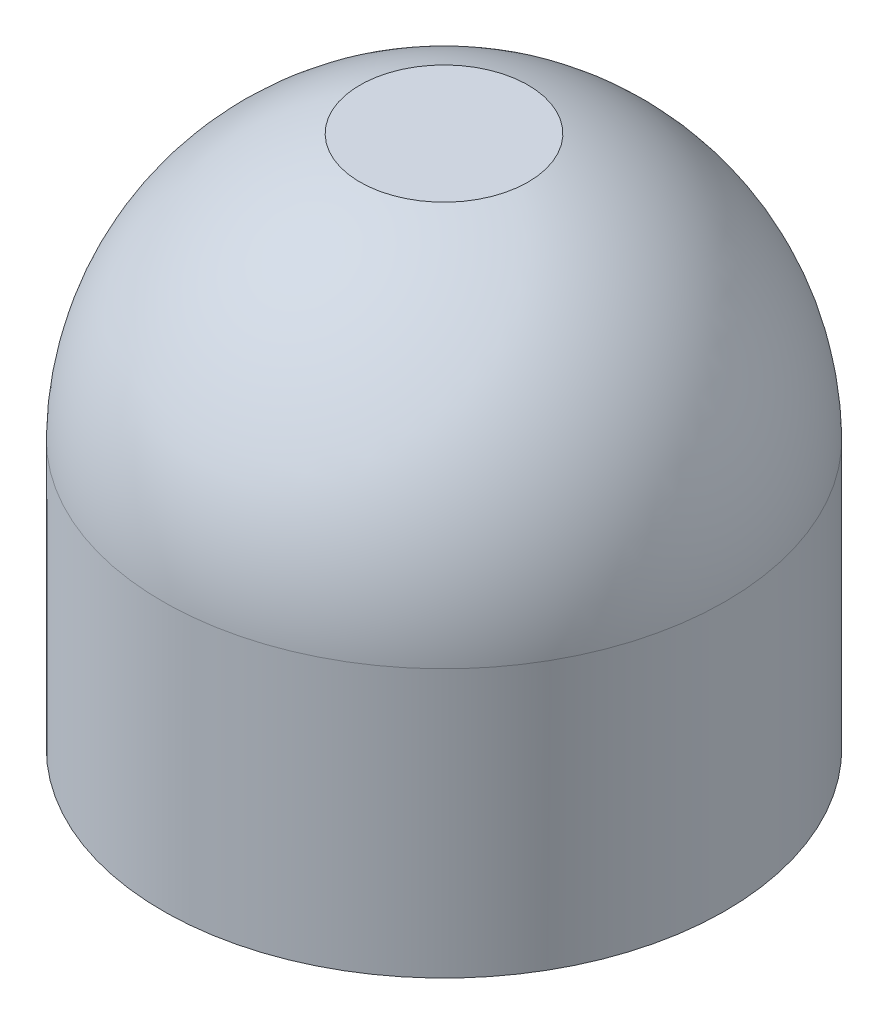
from build123d import *

# Parameters (mm, degrees)
SKETCH1_R           = 5.25
SKETCH1_R_2         = 4.5
BOSS_EXTRUDE1_DEPTH = 5
CUT_EXTRUDE1_DEPTH  = 5
CUT_EXTRUDE2_DEPTH  = 2
SKETCH6_R           = 2
CUT_EXTRUDE4_DEPTH  = 0.35


with BuildPart() as part:
    # Sketch1 → Boss-Extrude1 (new body)
    with BuildSketch(Plane(origin=(0, 0, 0), x_dir=(1, 0, 0), z_dir=(0, 1, 0))):
        with Locations(Location((0, 0, 0), (0, 0, 270))):
            Circle(SKETCH1_R)
        with Locations(Location((0, 0, 0), (0, 0, 270))):
            Circle(SKETCH1_R_2, mode=Mode.SUBTRACT)
    extrude(amount=BOSS_EXTRUDE1_DEPTH)

    # Sketch2 → Cut-Extrude1 (cut)
    with BuildSketch(Plane(origin=(0, 0, 0), x_dir=(1, 0, 0), z_dir=(0, 1, 0))):
        Polygon((1.327689147, 3.795637322), (1.327689147, 5.701107087), (-1.5, 5.701107087), (-1.5, 3.701107087), align=None)
    extrude(amount=CUT_EXTRUDE1_DEPTH, mode=Mode.SUBTRACT)

    # Sketch4 → Revolve1 (revolve)
    with BuildSketch(Plane.XY):
        with BuildLine():
            Line((5.25, 5), (0, 5))
            Line((0, 5), (0, 10.18))
            ThreePointArc((0, 10.18), (3.687644912, 8.667004979), (5.25, 5))
        make_face()
    revolve(axis=Axis((0, 5, 0), (0, 1, 0)))

    # Sketch5 → Cut-Extrude2 (cut)
    with BuildSketch(Plane(origin=(0, 5, 0), x_dir=(-1, 0, 0), z_dir=(0, -1, 0))):
        with BuildLine():
            Line((1.5, 3.436931771), (1.5, 6))
            Line((1.5, 6), (-1.327689147, 6))
            Line((-1.327689147, 6), (-1.327689147, 3.507098734))
            ThreePointArc((-1.327689147, 3.507098734), (-0.093024772, -3.748846008), (1.5, 3.436931771))
        make_face()
    extrude(amount=-CUT_EXTRUDE2_DEPTH, mode=Mode.SUBTRACT)

    # Sketch6 → Cut-Extrude4 (cut)
    with BuildSketch(Plane(origin=(0, 10.29, 0), x_dir=(-1, 0, 0), z_dir=(0, -1, 0))):
        Circle(SKETCH6_R)
    extrude(amount=CUT_EXTRUDE4_DEPTH, mode=Mode.SUBTRACT)

    # Sweep1: sweep along a path in Sketch9
    with BuildLine(Plane(origin=(0, 1.5, 0), x_dir=(-1, 0, 0), z_dir=(0, -1, 0))) as sweep1_path:
        ThreePointArc((1.5, 4.242640687), (-0.090752997, -4.499084784), (-1.327689147, 4.299679236))
    # Friction Bump → Sweep1 (sweep)
    with BuildSketch(Plane.ZY.offset(-1.327689147)):
        Polygon((-4.299679236, 2.026185405), (-4.299679236, 1.426185405), (-4.099679236, 1.658472971), (-4.099679236, 1.7942723), align=None)
    sweep(path=sweep1_path.line)


solid = part.part
